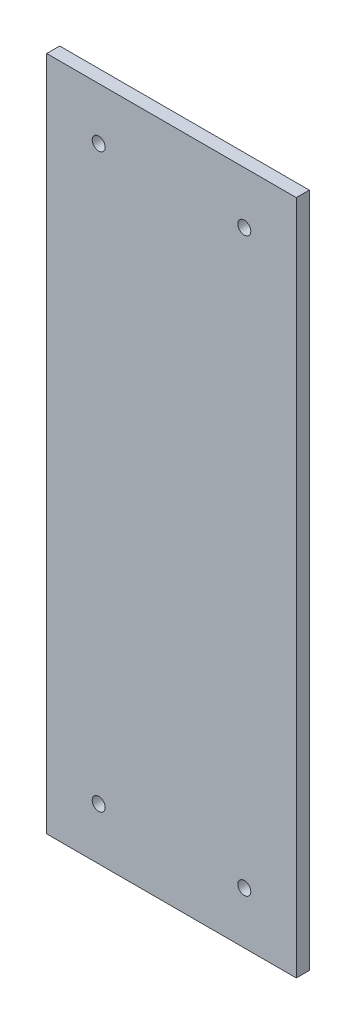
from build123d import *

# Parameters (mm, degrees)
SKETCH1_W            = 121.92
SKETCH1_H            = 330.2
BOSS_EXTRUDE1_DEPTH  = 6.35
SKETCH2_R            = 3.175
CUT_EXTRUDE1_DEPTH   = 6.35
LPATTERN1_COUNT      = 2
LPATTERN1_PITCH      = 71.12
LPATTERN1_COUNT_DIR2 = 2
LPATTERN1_PITCH_DIR2 = 279.4


with BuildPart() as part:
    # Sketch1 → Boss-Extrude1 (new body)
    with BuildSketch(Plane.XY):
        with Locations((60.96, 165.1)):
            Rectangle(SKETCH1_W, SKETCH1_H)
    extrude(amount=BOSS_EXTRUDE1_DEPTH)

    # Sketch2 → Cut-Extrude1 (cut)
    with BuildSketch(Plane.XY.offset(6.35)):
        with Locations((25.4, 304.8)):
            Circle(SKETCH2_R)
    cut_extrude1 = extrude(amount=-CUT_EXTRUDE1_DEPTH, mode=Mode.SUBTRACT)

    # LPattern1: Cut-Extrude1 2 × 2
    with Locations(*[(i * LPATTERN1_PITCH, -j * LPATTERN1_PITCH_DIR2, 0) for i in range(LPATTERN1_COUNT) for j in range(LPATTERN1_COUNT_DIR2) if (i, j) != (0, 0)]):
        add(cut_extrude1, mode=Mode.SUBTRACT)


solid = part.part
